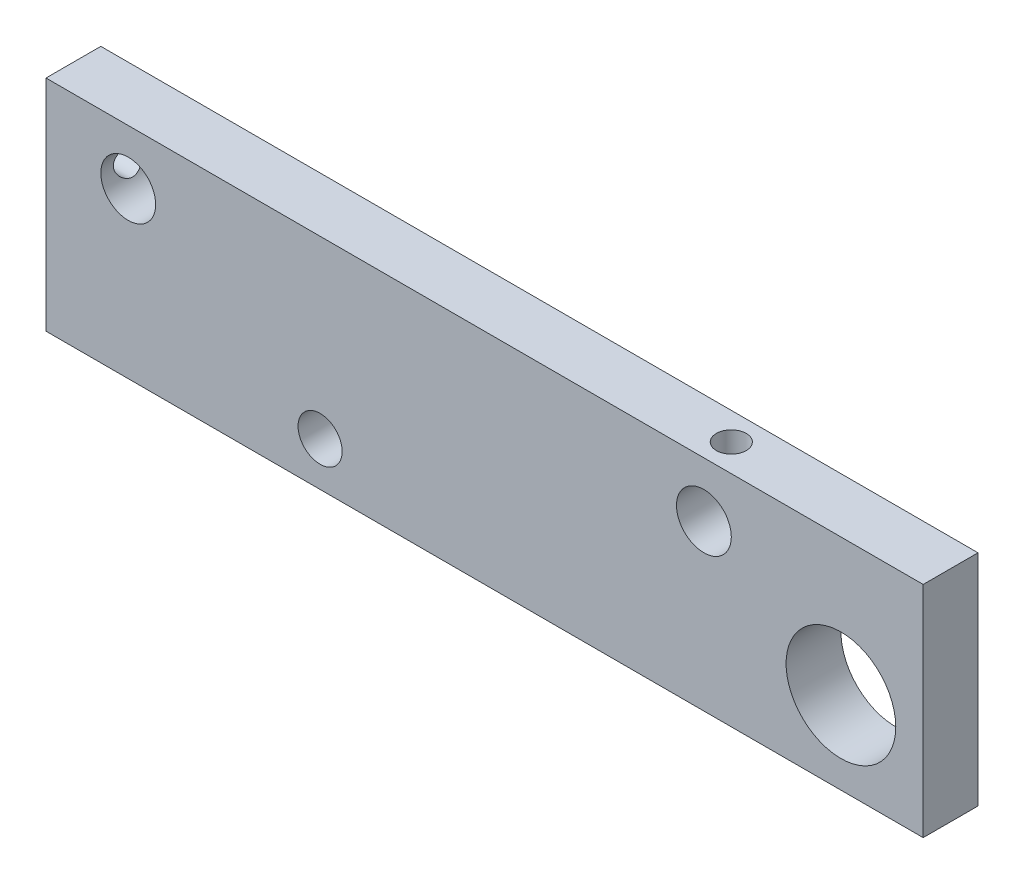
from build123d import *

# Parameters (mm, degrees)
SKETCH1_W                           = 101.6
SKETCH1_H                           = 25.4
SKETCH1_R                           = 6.35
SKETCH1_R_2                         = 3.175
BOSS_EXTRUDE1_DEPTH                 = 6.35
F_8_32_TAPPED_HOLE1_REACH           = 105.419
F_8_32_TAPPED_HOLE1_BORE_R          = 1.7272
F_8_32_TAPPED_HOLE1_ON_FACE_2_REACH = 82.385
F_8_32_TAPPED_HOLE1_BORE_2_R        = 1.7272
F_8_32_TAPPED_HOLE2_D               = 3.4544
F_8_32_TAPPED_HOLE2_DEPTH           = 10.668
F_8_32_TAPPED_HOLE2_TIP             = 1.037806461
F_1_4_20_TAPPED_HOLE1_D             = 5.1054


with BuildPart() as part:
    # Sketch1 → Boss-Extrude1 (new body)
    with BuildSketch(Plane.XY):
        with Locations((50.8, 12.7)):
            Rectangle(SKETCH1_W, SKETCH1_H)
        with Locations((92.075, 9.525)):
            Circle(SKETCH1_R, mode=Mode.SUBTRACT)
        with Locations((9.525, 19.05)):
            Circle(SKETCH1_R_2, mode=Mode.SUBTRACT)
        with Locations((76.2, 19.05)):
            Circle(SKETCH1_R_2, mode=Mode.SUBTRACT)
    extrude(amount=BOSS_EXTRUDE1_DEPTH)

    # #8-32 Tapped Hole1 bore (on position points) → #8-32 Tapped Hole1 (cut, up to next)
    with BuildSketch(Plane(origin=(0, 19.05, 3.175), x_dir=(0, 0, -1), z_dir=(-1, 0, 0)), mode=Mode.PRIVATE) as f_8_32_tapped_hole1_sk1:
        Circle(F_8_32_TAPPED_HOLE1_BORE_R)
    f_8_32_tapped_hole1_tool1 = extrude(f_8_32_tapped_hole1_sk1.sketch, amount=-F_8_32_TAPPED_HOLE1_REACH, mode=Mode.PRIVATE) & part.part
    add(f_8_32_tapped_hole1_tool1.solids().sort_by_distance((0, 19.05, 3.175))[0], mode=Mode.SUBTRACT)

    # #8-32 Tapped Hole1 bore 2 (on position points) → #8-32 Tapped Hole1 on face 2 (cut, up to next)
    with BuildSketch(Plane(origin=(76.2, 25.4, 3.175), x_dir=(0, 0, 1), z_dir=(0, 1, 0)), mode=Mode.PRIVATE) as f_8_32_tapped_hole1_on_face_2_sk1:
        Circle(F_8_32_TAPPED_HOLE1_BORE_2_R)
    f_8_32_tapped_hole1_on_face_2_tool1 = extrude(f_8_32_tapped_hole1_on_face_2_sk1.sketch, amount=-F_8_32_TAPPED_HOLE1_ON_FACE_2_REACH, mode=Mode.PRIVATE) & part.part
    add(f_8_32_tapped_hole1_on_face_2_tool1.solids().sort_by_distance((76.2, 25.4, 3.175))[0], mode=Mode.SUBTRACT)

    # #8-32 Tapped Hole2
    with Locations(Plane(origin=(81.28, 0, 3.175), x_dir=(0, 0, -1), z_dir=(0, -1, 0))):
        with Locations((0, 0), (0, -25.4), (0, -68.58), (0, -12.7)):
            Hole(F_8_32_TAPPED_HOLE2_D / 2, depth=F_8_32_TAPPED_HOLE2_DEPTH)
            with Locations((0, 0, -(F_8_32_TAPPED_HOLE2_DEPTH + F_8_32_TAPPED_HOLE2_TIP / 2))):  # 118° drill point
                Cone(0, F_8_32_TAPPED_HOLE2_D / 2, F_8_32_TAPPED_HOLE2_TIP, mode=Mode.SUBTRACT)

    # 1/4-20 Tapped Hole1 (through all)
    with Locations(Plane(origin=(31.75, 5.08, 0), x_dir=(-1, 0, 0), z_dir=(0, 0, -1))):
        with Locations((0, 0)):
            Hole(F_1_4_20_TAPPED_HOLE1_D / 2)


solid = part.part
